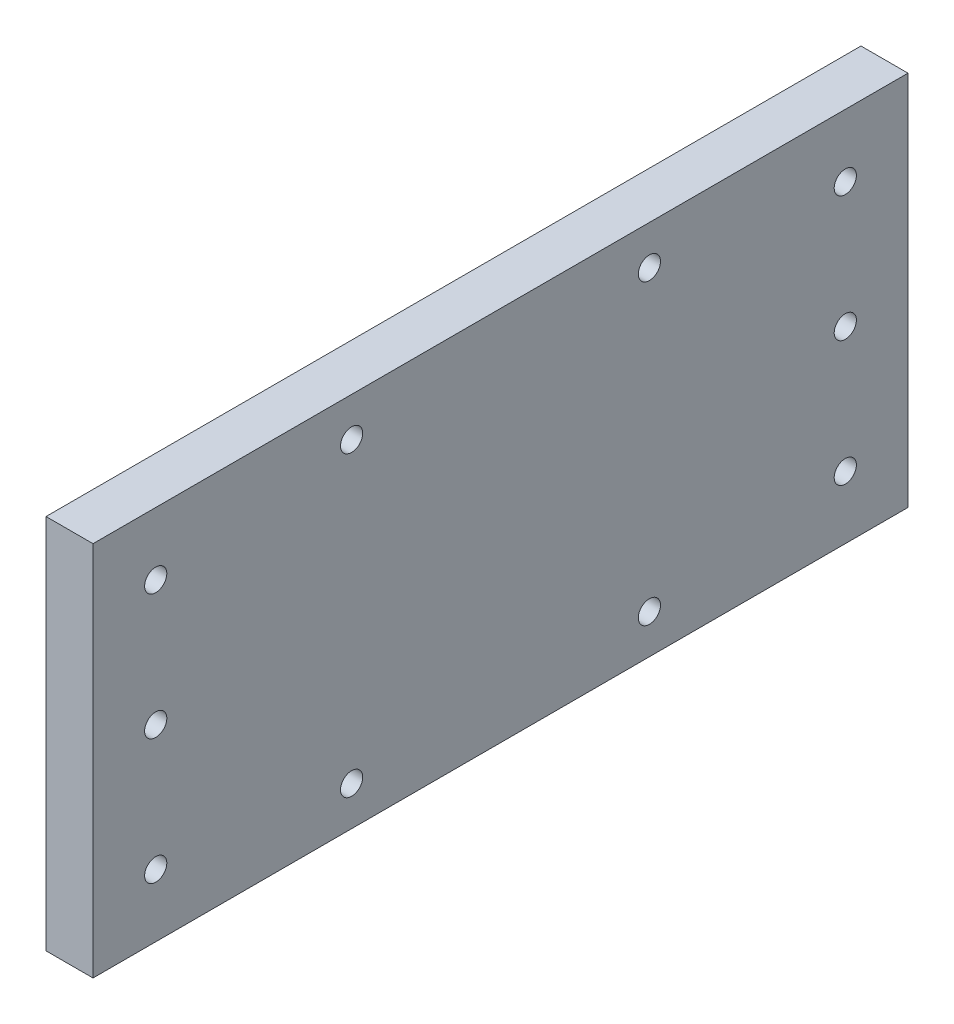
from build123d import *

# Parameters (mm, degrees)
SKETCH1_W             = 9.525
SKETCH1_H             = 76.2
BOSS_EXTRUDE1_DEPTH   = 165.1
F_8_CLEARANCE_HOLE1_D = 4.4958
F_8_CLEARANCE_HOLE2_D = 4.4958


with BuildPart() as part:
    # Sketch1 → Boss-Extrude1 (new body)
    with BuildSketch(Plane.XY):
        Rectangle(SKETCH1_W, SKETCH1_H)
    extrude(amount=BOSS_EXTRUDE1_DEPTH)

    # #8 Clearance Hole1 (through all)
    with Locations(Plane(origin=(4.7625, 0, 0), x_dir=(0, 0, -1), z_dir=(1, 0, 0))):
        with Locations((-52.3875, -30.1625), (-112.7125, 30.1625), (-112.7125, -30.1625), (-52.3875, 30.1625)):
            Hole(F_8_CLEARANCE_HOLE1_D / 2)

    # #8 Clearance Hole2 (through all)
    with Locations(Plane(origin=(4.7625, 0, 0), x_dir=(0, 0, -1), z_dir=(1, 0, 0))):
        with Locations((-152.4, 25.4), (-152.4, 0), (-152.4, -25.4), (-12.7, 25.4), (-12.7, 0), (-12.7, -25.4)):
            Hole(F_8_CLEARANCE_HOLE2_D / 2)


solid = part.part
